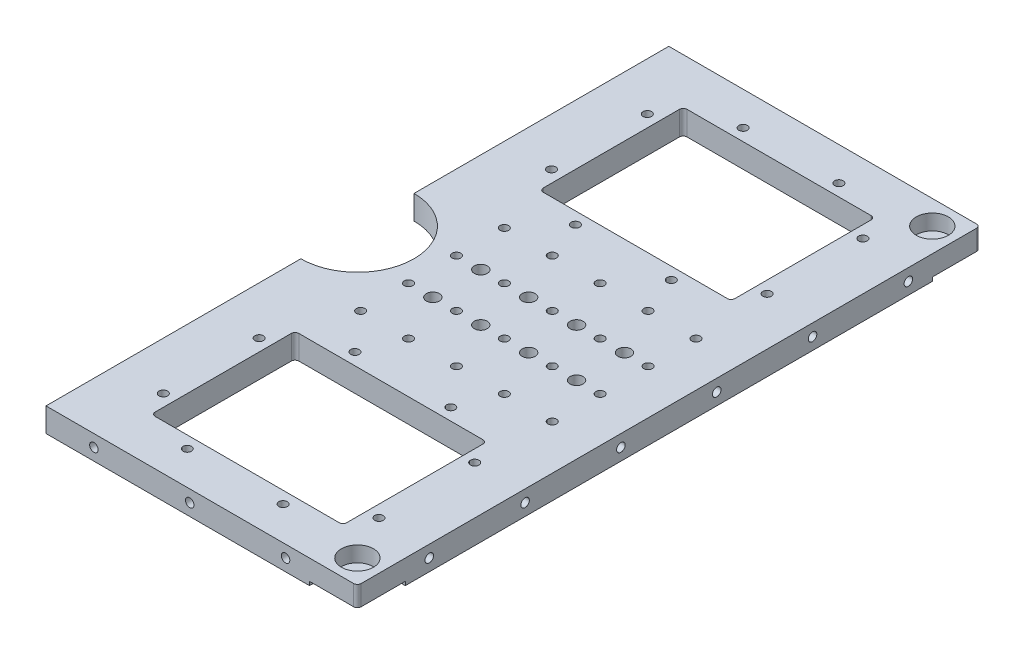
from build123d import *

# Parameters (mm, degrees)
BOSS_EXTRUDE1_DEPTH                            = 6.35
LPATTERN1_COUNT                                = 6
LPATTERN1_PITCH                                = 25.4
LPATTERN2_COUNT                                = 3
LPATTERN2_PITCH                                = 25.4
SKETCH5_W                                      = 50.8
SKETCH5_H                                      = 38.1
FEEDTHROUGHS_DEPTH                             = 6.35
F_4_40_TAPPED_HOLE_Y_D                         = 2.2606
FILLET1_R                                      = 1
CBORE_FOR_4_SOCKET_HEAD_CAP_SCREW1_D           = 3.2639
CBORE_FOR_4_SOCKET_HEAD_CAP_SCREW1_DEPTH       = 8.89
CBORE_FOR_4_SOCKET_HEAD_CAP_SCREW1_CBORE_D     = 8.509
CBORE_FOR_4_SOCKET_HEAD_CAP_SCREW1_CBORE_DEPTH = 4.1148
CBORE_FOR_4_SOCKET_HEAD_CAP_SCREW1_TIP         = 0.980574487
F_8_32_TAPPED_HEAT_STRAP_D                     = 3.4544
F_4_40_TAPPED_GRID_D                           = 2.2606
LPATTERN4_COUNT                                = 6
LPATTERN4_PITCH                                = 12.7
LPATTERN4_COUNT_DIR2                           = 3
LPATTERN4_PITCH_DIR2                           = 12.7
LPATTERN5_COUNT                                = 2
LPATTERN5_PITCH                                = 12.7
LPATTERN5_COUNT_DIR2                           = 5
LPATTERN5_PITCH_DIR2                           = 12.7
BAR_CUTOUTS_R                                  = 1
BAR_CUTOUTS_W                                  = 12.7
BAR_CUTOUTS_H                                  = 12.7
CUT_EXTRUDE1_DEPTH                             = 1
FILLET2_R                                      = 1


with BuildPart() as part:
    # Sketch1 → Boss-Extrude1 (new body)
    with BuildSketch(Plane(origin=(0, 0, 0), x_dir=(1, 0, 0), z_dir=(0, 1, 0))):
        with BuildLine():
            Line((0, -15), (0, -82.55))
            Line((0, -82.55), (82.55, -82.55))
            Line((82.55, -82.55), (82.55, 82.55))
            Line((82.55, 82.55), (0, 82.55))
            Line((0, 82.55), (0, 15))
            ThreePointArc((0, 15), (15, 0), (0, -15))
        make_face()
    extrude(amount=BOSS_EXTRUDE1_DEPTH)

    # Sketch2 → #4-40 Tapped Hole - Z (revolve, cut)
    with BuildSketch(Plane(origin=(82.55, 3.175, 63.5), x_dir=(0, 0, -1), z_dir=(0, 1, 0))):
        Polygon((0, 0), (0, 8.279152758), (1.1303, 7.6), (1.1303, 0), align=None)
    f_4_40_tapped_hole_z = revolve(axis=Axis((88.9, 3.175, 63.5), (-1, 0, 0)), mode=Mode.SUBTRACT)

    # LPattern1: #4-40 Tapped Hole - Z ×6
    with Locations(*[(0, 0, -i * LPATTERN1_PITCH) for i in range(1, LPATTERN1_COUNT)]):
        add(f_4_40_tapped_hole_z, mode=Mode.SUBTRACT)

    # Sketch3 → #4-40 Tapped Hole - X (revolve, cut)
    with BuildSketch(Plane(origin=(63.5, 3.175, 82.55), x_dir=(0, -1, 0), z_dir=(1, 0, 0))):
        Polygon((0, 0), (0, 8.279152758), (1.1303, 7.6), (1.1303, 0), align=None)
    f_4_40_tapped_hole_x = revolve(axis=Axis((63.5, 3.175, 88.9), (0, 0, -1)), mode=Mode.SUBTRACT)

    # LPattern2: #4-40 Tapped Hole - X ×3
    with Locations(*[(-i * LPATTERN2_PITCH, 0, 0) for i in range(1, LPATTERN2_COUNT)]):
        add(f_4_40_tapped_hole_x, mode=Mode.SUBTRACT)

    # Mirror1: #4-40 Tapped Hole - X across plane
    add(f_4_40_tapped_hole_x.mirror(Plane.XY), mode=Mode.SUBTRACT)

    # Mirror1 copy 1 sketch → Mirror1 copy 1 (revolve, cut)
    with BuildSketch(Plane(origin=(38.1, 3.175, -82.55), x_dir=(0, -1, 0), z_dir=(1, 0, 0))):
        Polygon((0, 0), (0, -8.279152758), (1.1303, -7.6), (1.1303, 0), align=None)
    revolve(axis=Axis((38.1, 3.175, -88.9), (0, 0, -1)), mode=Mode.SUBTRACT)

    # Mirror1 copy 2 sketch → Mirror1 copy 2 (revolve, cut)
    with BuildSketch(Plane(origin=(12.7, 3.175, -82.55), x_dir=(0, -1, 0), z_dir=(1, 0, 0))):
        Polygon((0, 0), (0, -8.279152758), (1.1303, -7.6), (1.1303, 0), align=None)
    revolve(axis=Axis((12.7, 3.175, -88.9), (0, 0, -1)), mode=Mode.SUBTRACT)

    # Sketch5 → Feedthroughs (cut)
    with BuildSketch(Plane(origin=(0, 0, 0), x_dir=(1, 0, 0), z_dir=(0, 1, 0))):
        with Locations((41.275, 51.45)):
            Rectangle(SKETCH5_W, SKETCH5_H)
        with Locations((41.275, -51.45)):
            Rectangle(SKETCH5_W, SKETCH5_H)
    extrude(amount=FEEDTHROUGHS_DEPTH, mode=Mode.SUBTRACT)

    # #4-40 Tapped Hole - Y (through all)
    with Locations(Plane(origin=(53.975, 6.35, -73.675), x_dir=(0, 0, 1), z_dir=(0, 1, 0))):
        with Locations((0, 0), (9.525, 15.875), (44.45, 0), (44.45, -25.4), (9.525, -41.275), (0, -25.4), (34.925, -41.275), (34.925, 15.875)):
            f_4_40_tapped_hole_y = Hole(F_4_40_TAPPED_HOLE_Y_D / 2)

    # #4-40 Tapped Hole - Y Mirror: #4-40 Tapped Hole - Y across plane
    add(f_4_40_tapped_hole_y.mirror(Plane.XY), mode=Mode.SUBTRACT)

    # Fillet1
    fillet1_edges = [part.edges().sort_by_distance(p)[0] for p in [
        (15.875, 3.175, -70.5),
        (15.875, 3.175, -32.4),
        (66.675, 3.175, -32.4),
        (66.675, 3.175, -70.5),
        (15.875, 3.175, 70.5),
        (66.675, 3.175, 70.5),
        (66.675, 3.175, 32.4),
        (15.875, 3.175, 32.4),
    ]]
    fillet(fillet1_edges, radius=FILLET1_R)

    # CBORE for #4 Socket Head Cap Screw1
    with Locations(Plane(origin=(76.2, 6.35, -76.2), x_dir=(0, 0, 1), z_dir=(0, 1, 0))):
        with Locations((0, 0), (152.4, 0)):
            CounterBoreHole(CBORE_FOR_4_SOCKET_HEAD_CAP_SCREW1_D / 2, CBORE_FOR_4_SOCKET_HEAD_CAP_SCREW1_CBORE_D / 2, CBORE_FOR_4_SOCKET_HEAD_CAP_SCREW1_CBORE_DEPTH, depth=CBORE_FOR_4_SOCKET_HEAD_CAP_SCREW1_DEPTH)
            with Locations((0, 0, -(CBORE_FOR_4_SOCKET_HEAD_CAP_SCREW1_DEPTH + CBORE_FOR_4_SOCKET_HEAD_CAP_SCREW1_TIP / 2))):  # 118° drill point
                Cone(0, CBORE_FOR_4_SOCKET_HEAD_CAP_SCREW1_D / 2, CBORE_FOR_4_SOCKET_HEAD_CAP_SCREW1_TIP, mode=Mode.SUBTRACT)

    # #8-32 Tapped Heat strap (through all)
    with Locations(Plane(origin=(26.35, 6.35, -6.35), x_dir=(0, 0, 1), z_dir=(0, 1, 0))):
        with Locations((0, 0), (0, 12.7), (0, 25.4), (0, 38.1), (12.7, 38.1), (12.7, 25.4), (12.7, 12.7), (12.7, 0)):
            Hole(F_8_32_TAPPED_HEAT_STRAP_D / 2)

    # #4-40 Tapped Grid (through all)
    with Locations(Plane(origin=(70.7, 6.35, -6.35), x_dir=(0, 0, 1), z_dir=(0, 1, 0))):
        with Locations((0, 0)):
            f_4_40_tapped_grid = Hole(F_4_40_TAPPED_GRID_D / 2)

    # LPattern4: 4-40 Tapped Grid 6 × 3, 3 skipped
    with Locations(*[(-i * LPATTERN4_PITCH, 0, j * LPATTERN4_PITCH_DIR2) for i in range(LPATTERN4_COUNT) for j in range(LPATTERN4_COUNT_DIR2) if (i, j) not in ((0, 0), (5, 0), (5, 1), (5, 2))]):
        add(f_4_40_tapped_grid, mode=Mode.SUBTRACT)

    # LPattern5: 4-40 Tapped Grid 2 × 5, 4 skipped
    with Locations(*[(-j * LPATTERN5_PITCH_DIR2, 0, -i * LPATTERN5_PITCH) for i in range(LPATTERN5_COUNT) for j in range(LPATTERN5_COUNT_DIR2) if (i, j) not in ((0, 0), (0, 1), (0, 2), (0, 3), (0, 4))]):
        add(f_4_40_tapped_grid, mode=Mode.SUBTRACT)

    # Bar_cutouts → Cut-Extrude1 (cut)
    with BuildSketch(Plane(origin=(0, 0, 0), x_dir=(1, 0, 0), z_dir=(0, 1, 0))):
        with Locations((69.85, 69.85)):
            Circle(BAR_CUTOUTS_R)
        with Locations((76.2, 76.2)):
            Rectangle(BAR_CUTOUTS_W, BAR_CUTOUTS_H)
        with BuildLine():
            ThreePointArc((70.85, 69.85), (70.557106781, 70.557106781), (69.85, 70.85))
            Line((69.85, 70.85), (69.85, 69.85))
            Line((69.85, 69.85), (70.85, 69.85))
        make_face()
        with BuildLine():
            Line((69.85, 69.85), (69.85, 70.85))
            ThreePointArc((69.85, 70.85), (69.142893219, 69.142893219), (70.85, 69.85))
            Line((70.85, 69.85), (69.85, 69.85))
        make_face()
        with BuildLine():
            ThreePointArc((69.85, -70.85), (70.557106781, -70.557106781), (70.85, -69.85))
            Line((70.85, -69.85), (69.85, -69.85))
            Line((69.85, -69.85), (69.85, -70.85))
        make_face()
        with BuildLine():
            Line((69.85, -69.85), (70.85, -69.85))
            ThreePointArc((70.85, -69.85), (69.142893219, -69.142893219), (69.85, -70.85))
            Line((69.85, -70.85), (69.85, -69.85))
        make_face()
        with Locations((69.85, -69.85)):
            Circle(BAR_CUTOUTS_R)
        with Locations((76.2, -76.2)):
            Rectangle(BAR_CUTOUTS_W, BAR_CUTOUTS_H)
    extrude(amount=CUT_EXTRUDE1_DEPTH, mode=Mode.SUBTRACT)

    # Fillet2
    fillet2_edges = [part.edges().sort_by_distance(p)[0] for p in [
        (82.55, 3.675, -82.55),
        (82.55, 3.675, 82.55),
    ]]
    fillet(fillet2_edges, radius=FILLET2_R)


solid = part.part
